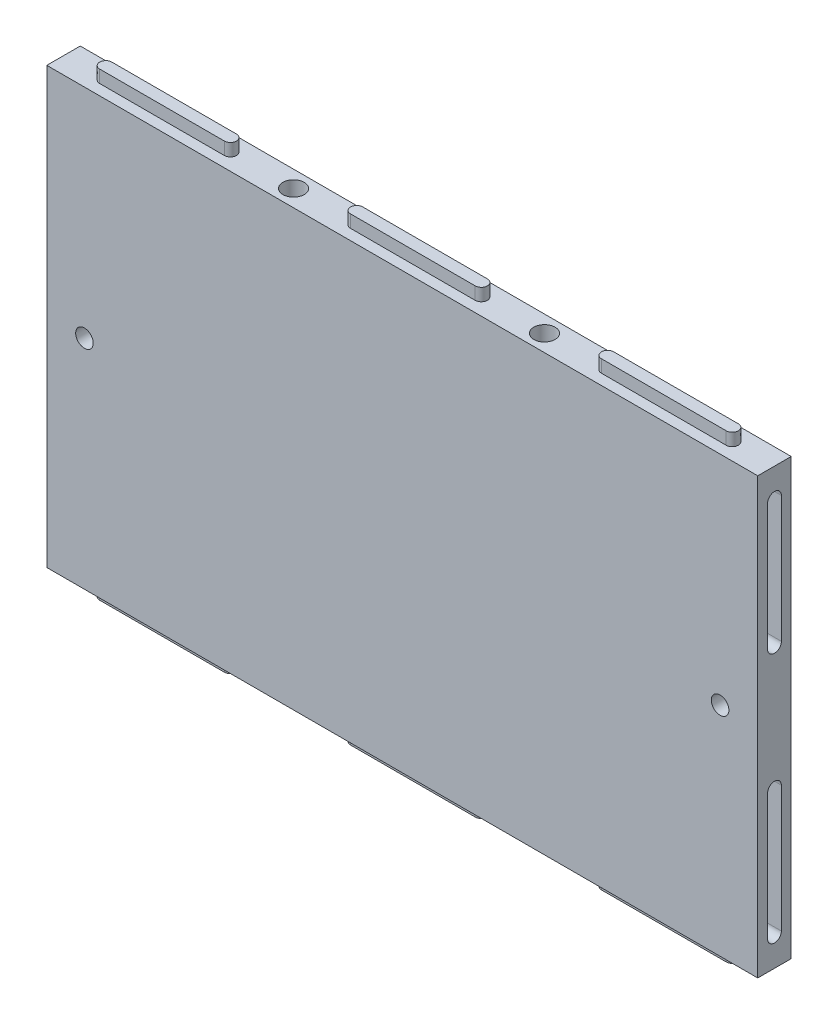
from build123d import *

# Parameters (mm, degrees)
IZIM1_W                     = 170
IZIM1_H                     = 104
Y_KSEKLIK_EKSTR_ZYON1_DEPTH = 4
Y_KSEKLIK_EKSTR_ZYON2_DEPTH = 55
IZIM3_R                     = 2.55
KES_EKSTR_ZYON1_DEPTH       = 12
KES_EKSTR_ZYON2_DEPTH       = 7
IZIM5_R                     = 2.1
KES_EKSTR_ZYON3_DEPTH       = 5
IZIM7_R                     = 4.4
KES_EKSTR_ZYON5_DEPTH       = 3.5


with BuildPart() as part:
    # Çizim1 → Yükseklik-Ekstrüzyon1 (new, symmetric)
    with BuildSketch(Plane.XY):
        Rectangle(IZIM1_W, IZIM1_H)
    extrude(amount=Y_KSEKLIK_EKSTR_ZYON1_DEPTH, both=True)

    # Çizim2 → Yükseklik-Ekstrüzyon2 (add, symmetric)
    with BuildSketch(Plane(origin=(0, 0, 0), x_dir=(1, 0, 0), z_dir=(0, 1, 0))):
        with BuildLine():
            Line((-74.9, 1.45), (-45.1, 1.45))
            ThreePointArc((-45.1, 1.45), (-43.65, 0), (-45.1, -1.45))
            Line((-45.1, -1.45), (-74.9, -1.45))
            ThreePointArc((-74.9, -1.45), (-76.35, 0), (-74.9, 1.45))
        make_face()
        with BuildLine():
            Line((-14.9, 1.45), (14.9, 1.45))
            ThreePointArc((14.9, 1.45), (16.35, 0), (14.9, -1.45))
            Line((14.9, -1.45), (-14.9, -1.45))
            ThreePointArc((-14.9, -1.45), (-16.35, 0), (-14.9, 1.45))
        make_face()
        with BuildLine():
            Line((45.1, 1.45), (74.9, 1.45))
            ThreePointArc((74.9, 1.45), (76.35, 0), (74.9, -1.45))
            Line((74.9, -1.45), (45.1, -1.45))
            ThreePointArc((45.1, -1.45), (43.65, 0), (45.1, 1.45))
        make_face()
    extrude(amount=Y_KSEKLIK_EKSTR_ZYON2_DEPTH, both=True)

    # Çizim3 → Kes-Ekstrüzyon1 (cut)
    with BuildSketch(Plane(origin=(0, 52, 0), x_dir=(1, 0, 0), z_dir=(0, 1, 0))):
        with Locations(Location((-30, 0, 0), (0, 0, 270))):
            Circle(IZIM3_R)
        with Locations(Location((30, 0, 0), (0, 0, 270))):
            Circle(IZIM3_R)
    kes_ekstr_zyon1 = extrude(amount=-KES_EKSTR_ZYON1_DEPTH, mode=Mode.SUBTRACT)

    # Aynalama1: Kes-Ekstrüzyon1 across plane
    add(kes_ekstr_zyon1.mirror(Plane.ZX), mode=Mode.SUBTRACT)

    # Çizim4 → Kes-Ekstrüzyon2 (cut)
    with BuildSketch(Plane.ZY.offset(85)):
        with BuildLine():
            Line((-1.65, -45.1), (-1.65, -14.9))
            ThreePointArc((-1.65, -14.9), (0, -13.25), (1.65, -14.9))
            Line((1.65, -14.9), (1.65, -45.1))
            ThreePointArc((1.65, -45.1), (0, -46.75), (-1.65, -45.1))
        make_face()
        with BuildLine():
            Line((-1.65, 14.9), (-1.65, 45.1))
            ThreePointArc((-1.65, 45.1), (0, 46.75), (1.65, 45.1))
            Line((1.65, 45.1), (1.65, 14.9))
            ThreePointArc((1.65, 14.9), (0, 13.25), (-1.65, 14.9))
        make_face()
    kes_ekstr_zyon2 = extrude(amount=-KES_EKSTR_ZYON2_DEPTH, mode=Mode.SUBTRACT)

    # Çizim5 → Kes-Ekstrüzyon3 (cut, symmetric)
    with BuildSketch(Plane.XY):
        with Locations((-76, 0)):
            Circle(IZIM5_R)
    kes_ekstr_zyon3 = extrude(amount=KES_EKSTR_ZYON3_DEPTH, both=True, mode=Mode.SUBTRACT)

    # Çizim7 → Kes-Ekstrüzyon5 (cut)
    with BuildSketch(Plane(origin=(0, 0, -4), x_dir=(-1, 0, 0), z_dir=(0, 0, -1))):
        with Locations((76, 0)):
            Circle(IZIM7_R)
    kes_ekstr_zyon5 = extrude(amount=-KES_EKSTR_ZYON5_DEPTH, mode=Mode.SUBTRACT)

    # Aynalama2: Kes-Ekstrüzyon2, Kes-Ekstrüzyon3, Kes-Ekstrüzyon5 across plane
    add(kes_ekstr_zyon2.mirror(Plane(origin=(0, 0, 0), x_dir=(0, 0, 1), z_dir=(1, 0, 0))), mode=Mode.SUBTRACT)
    add(kes_ekstr_zyon3.mirror(Plane(origin=(0, 0, 0), x_dir=(0, 0, 1), z_dir=(1, 0, 0))), mode=Mode.SUBTRACT)
    add(kes_ekstr_zyon5.mirror(Plane(origin=(0, 0, 0), x_dir=(0, 0, 1), z_dir=(1, 0, 0))), mode=Mode.SUBTRACT)


solid = part.part
